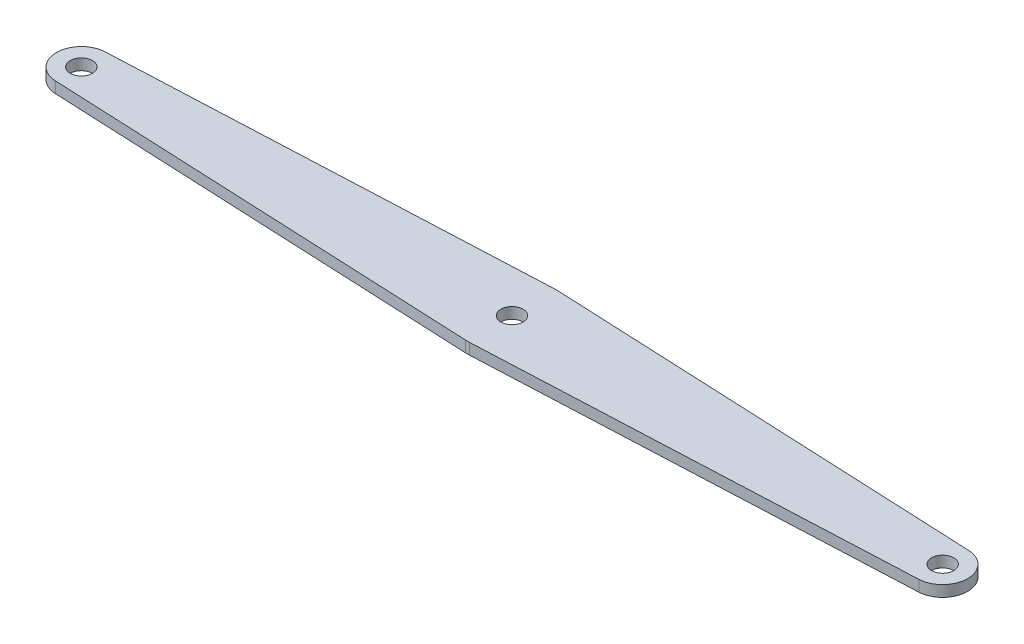
from build123d import *

# Parameters (mm, degrees)
EXTRUDE_448_DEPTH     = 2
SKETCH_2_R            = 2
CUT_EXTRUDE_659_DEPTH = 83.412799184
SKETCH_3_R            = 2
CUT_EXTRUDE_885_DEPTH = 83.412799184


with BuildPart() as part:
    # Эскиз1 → Extrude 448 (new body)
    with BuildSketch(Plane(origin=(0, 0, 0), x_dir=(1, 0, 0), z_dir=(0, 1, 0))):
        with BuildLine():
            Line((-77.703225806, 4.495408688), (-0.361290323, 7.991837667))
            Line((-0.361290323, 7.991837667), (0.361290323, 7.991837667))
            Line((0.361290323, 7.991837667), (77.703225806, 4.495408688))
            ThreePointArc((77.703225806, 4.495408688), (82, 0), (77.703225806, -4.495408688))
            Line((77.703225806, -4.495408688), (0.361290323, -7.991837667))
            Line((0.361290323, -7.991837667), (-0.361290323, -7.991837667))
            Line((-0.361290323, -7.991837667), (-77.703225806, -4.495408688))
            ThreePointArc((-77.703225806, -4.495408688), (-82, 0), (-77.703225806, 4.495408688))
        make_face()
    extrude(amount=EXTRUDE_448_DEPTH)

    # Эскиз2 → Cut-Extrude 659 (cut, through all)
    with BuildSketch(Plane(origin=(0, 2, 0), x_dir=(1, 0, 0), z_dir=(0, 1, 0))):
        with Locations(Location((0, 0, 0), (0, 0, 270))):
            Circle(SKETCH_2_R)
    extrude(amount=-CUT_EXTRUDE_659_DEPTH, mode=Mode.SUBTRACT)

    # Эскиз3 → Cut-Extrude 885 (cut, through all)
    with BuildSketch(Plane(origin=(0, 2, 0), x_dir=(1, 0, 0), z_dir=(0, 1, 0))):
        with Locations(Location((-77.5, 0, 0), (0, 0, 270))):
            Circle(SKETCH_3_R)
        with Locations(Location((77.5, 0, 0), (0, 0, 270))):
            Circle(SKETCH_3_R)
    extrude(amount=-CUT_EXTRUDE_885_DEPTH, mode=Mode.SUBTRACT)


solid = part.part
